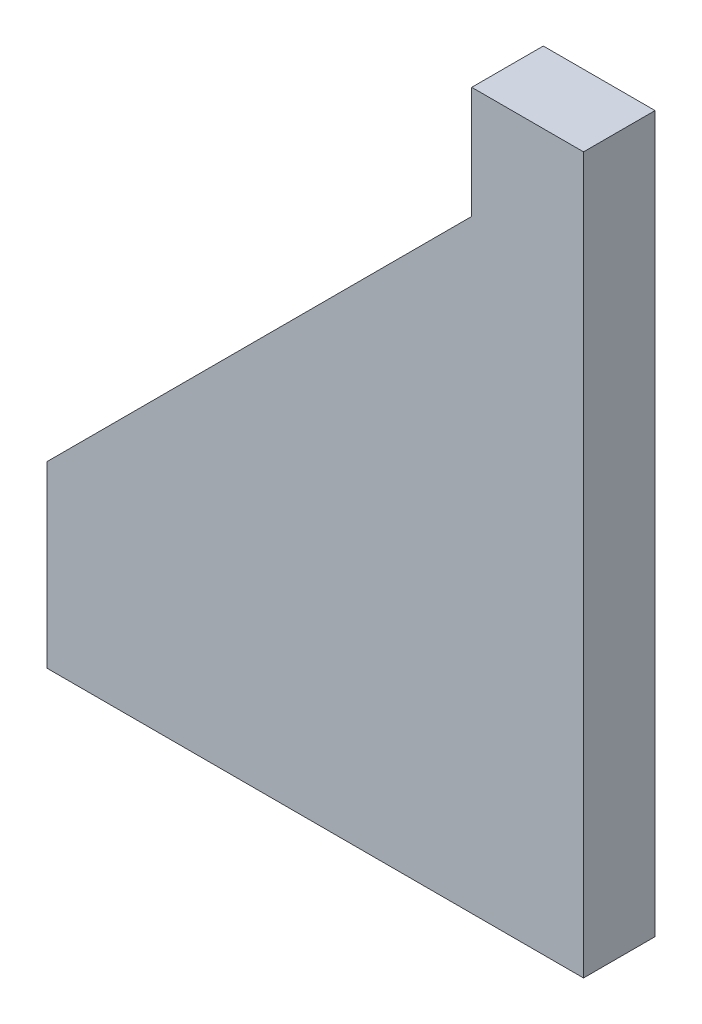
from build123d import *

# Parameters (mm, degrees)
SALIENTE_EXTRUIR2_DEPTH = 40


with BuildPart() as part:
    # Croquis1 → Saliente-Extruir2 (new body)
    with BuildSketch(Plane.XY):
        Polygon((-15.628610957, 282.341736931), (-15.628610957, 344.841736931), (46.871389043, 344.841736931), (46.871389043, -55.158263069), (-253.128610957, -55.158263069), (-253.128610957, 44.841736931), align=None)
    extrude(amount=SALIENTE_EXTRUIR2_DEPTH)


solid = part.part
